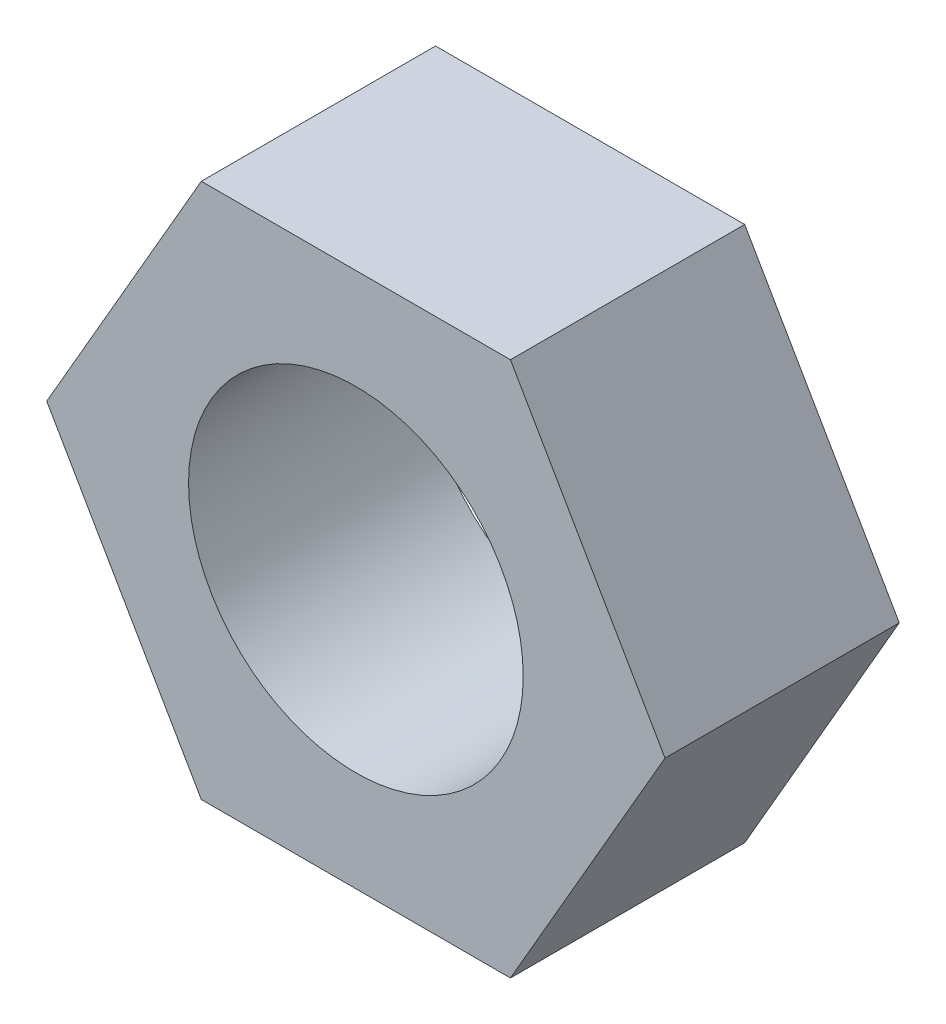
from build123d import *

# Parameters (mm, degrees)
SKETCH_1_R      = 2.5
EXTRUDE_1_DEPTH = 3.5


with BuildPart() as part:
    # 草图1 → 凸台-拉伸1 (new body)
    with BuildSketch(Plane.XY):
        Polygon((4.618802154, 0), (2.309401077, 4), (-2.309401077, 4), (-4.618802154, 0), (-2.309401077, -4), (2.309401077, -4), align=None)
        Circle(SKETCH_1_R, mode=Mode.SUBTRACT)
    extrude(amount=EXTRUDE_1_DEPTH)


solid = part.part
